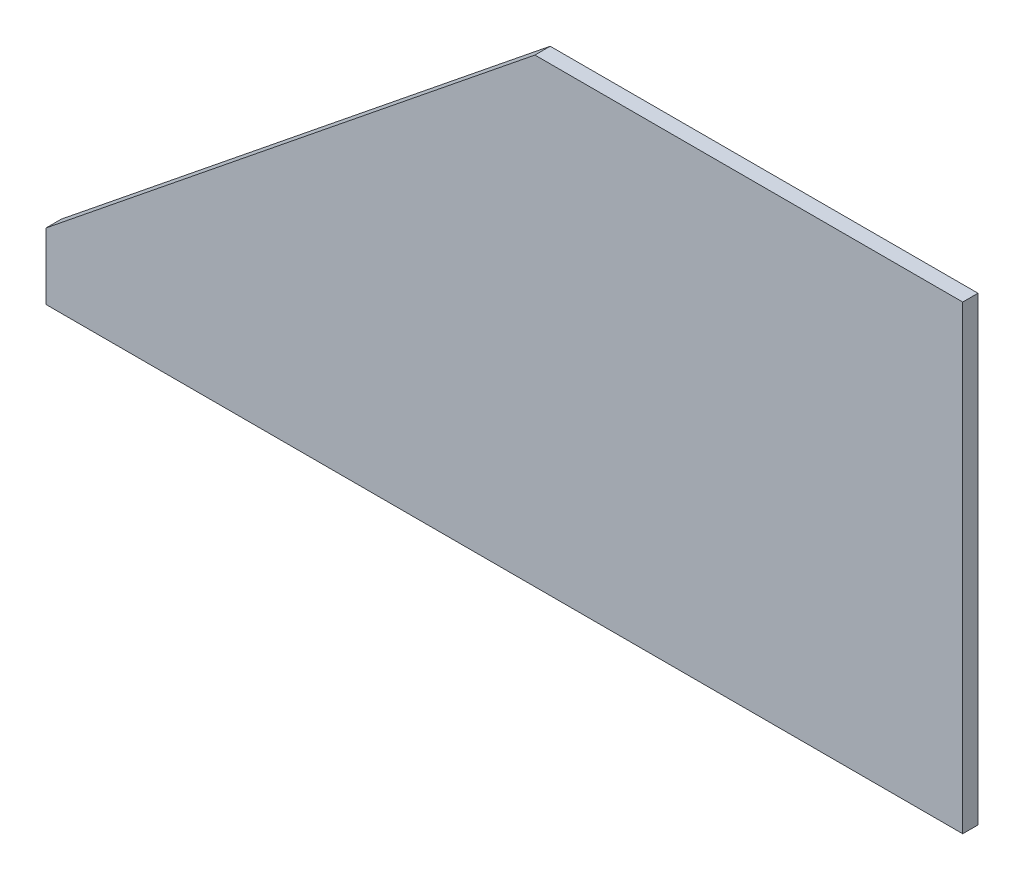
from build123d import *

# Parameters (mm, degrees)
BOSS_EXTRUDE1_DEPTH = 6.35


with BuildPart() as part:
    # Sketch1 → Boss-Extrude1 (new body)
    with BuildSketch(Plane.XY):
        Polygon((0, 0), (203.2, 163.83), (381, 163.83), (381, -27.559), (0, -27.559), align=None)
    extrude(amount=BOSS_EXTRUDE1_DEPTH)


solid = part.part
